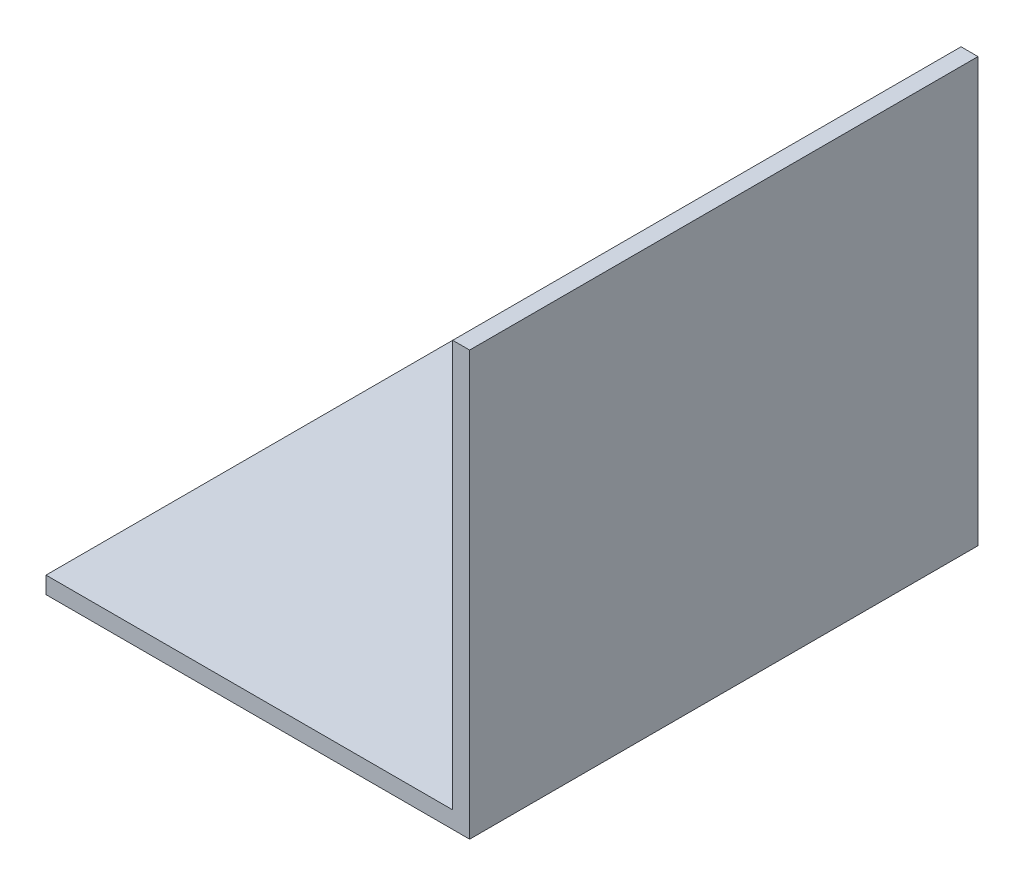
from build123d import *

# Parameters (mm, degrees)
BOSS_EXTRUDE1_DEPTH = 60


with BuildPart() as part:
    # Sketch1 → Boss-Extrude1 (new body)
    with BuildSketch(Plane.XY):
        Polygon((-31.160131748, -13.564037015), (18.839868252, -13.564037015), (18.839868252, 36.435962985), (16.839868252, 36.435962985), (16.839868252, -11.564037015), (-31.160131748, -11.564037015), align=None)
    extrude(amount=BOSS_EXTRUDE1_DEPTH)


solid = part.part
